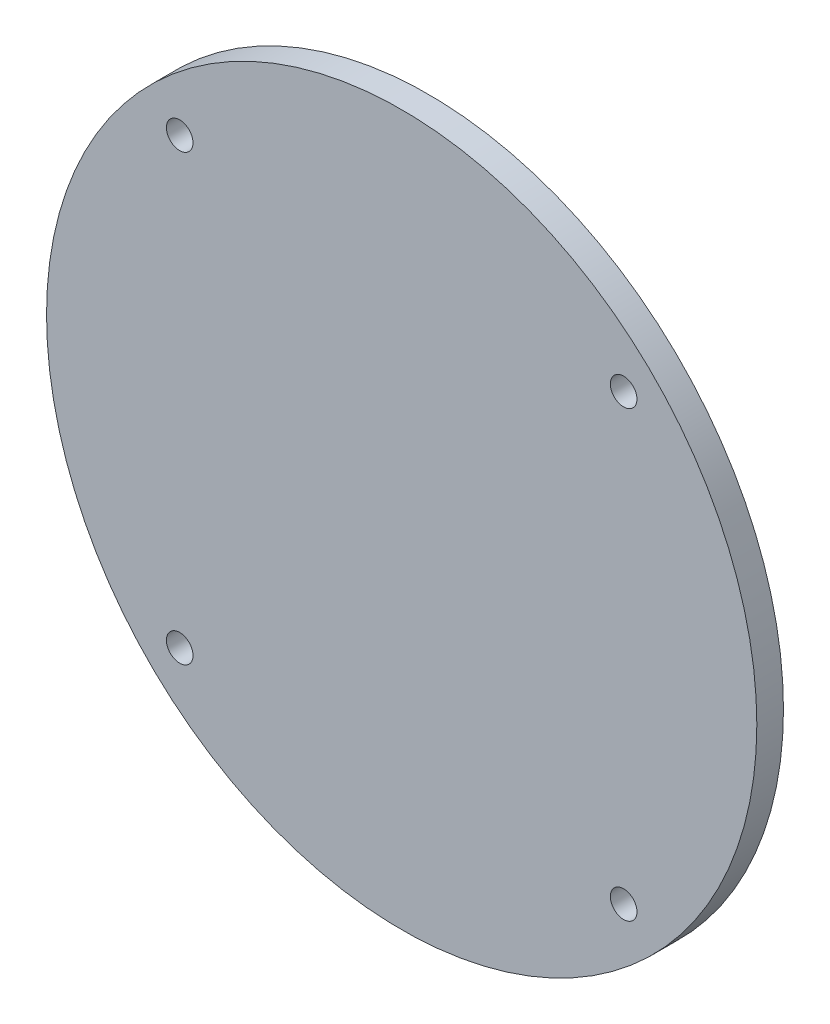
from build123d import *

# Parameters (mm, degrees)
SKETCH_1_R      = 40
SKETCH_1_R_2    = 1.5
EXTRUDE_1_DEPTH = 3


with BuildPart() as part:
    # 草图1 → 凸台-拉伸1 (new body)
    with BuildSketch(Plane.XY):
        Circle(SKETCH_1_R)
        with Locations((-25, 25)):
            Circle(SKETCH_1_R_2, mode=Mode.SUBTRACT)
        with Locations((25, 25)):
            Circle(SKETCH_1_R_2, mode=Mode.SUBTRACT)
        with Locations((25, -25)):
            Circle(SKETCH_1_R_2, mode=Mode.SUBTRACT)
        with Locations((-25, -25)):
            Circle(SKETCH_1_R_2, mode=Mode.SUBTRACT)
    extrude(amount=EXTRUDE_1_DEPTH)


solid = part.part
